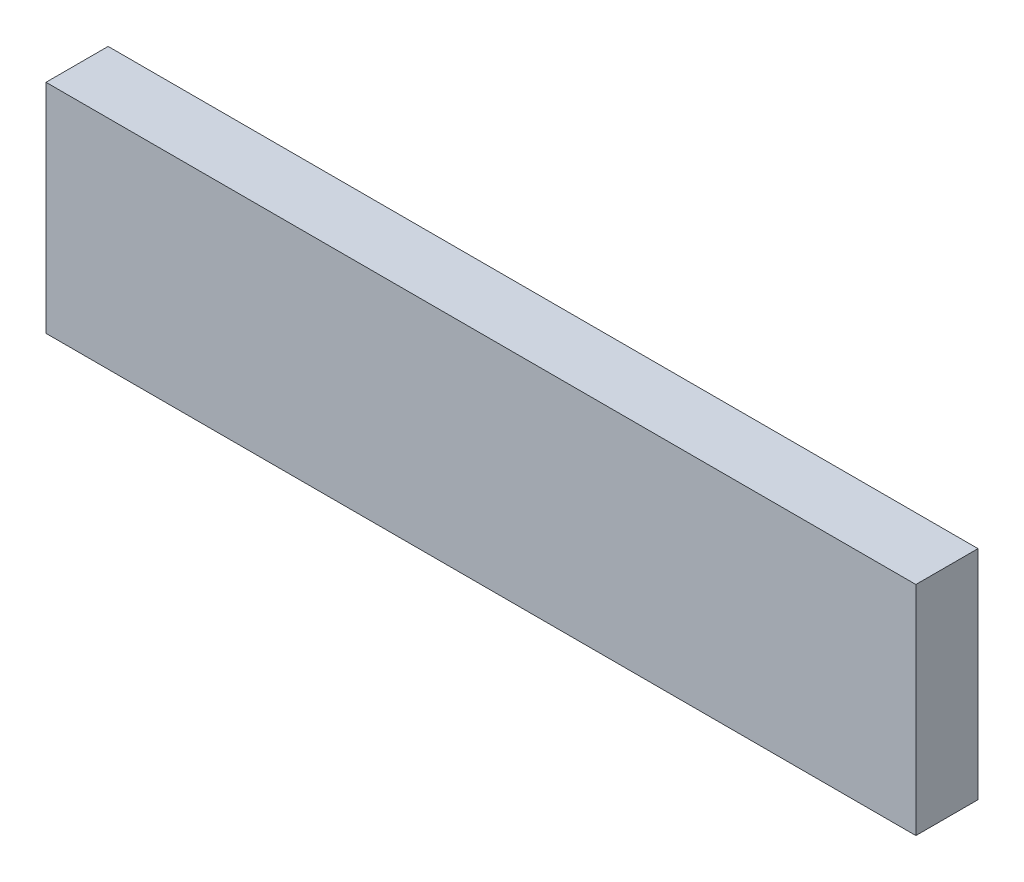
from build123d import *

# Parameters (mm, degrees)
SKETCH_1_W      = 280
SKETCH_1_H      = 70
EXTRUDE_1_DEPTH = 20


with BuildPart() as part:
    # 草图1 → 凸台-拉伸1 (new body)
    with BuildSketch(Plane.XY):
        Rectangle(SKETCH_1_W, SKETCH_1_H)
    extrude(amount=EXTRUDE_1_DEPTH)


solid = part.part
